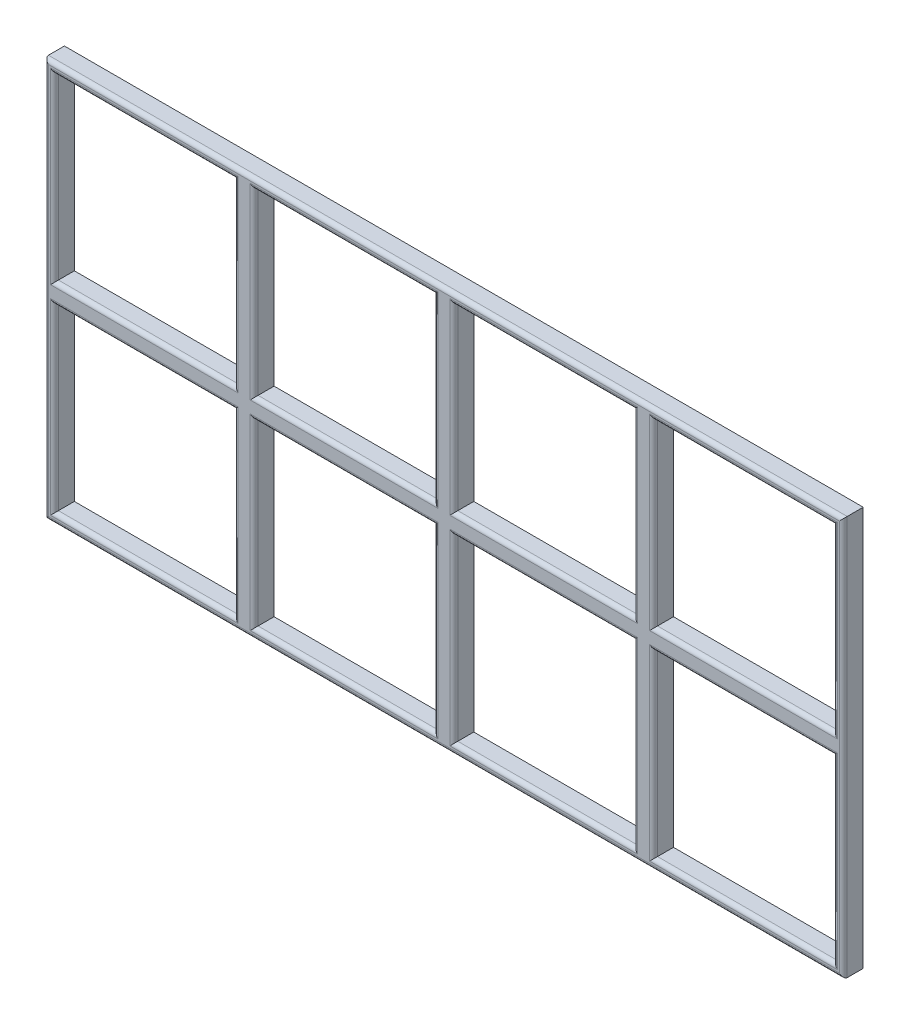
from build123d import *

# Parameters (mm, degrees)
SKETCH2_W           = 200
SKETCH2_H           = 100
SKETCH2_W_2         = 45
SKETCH2_H_2         = 45
BOSS_EXTRUDE1_DEPTH = 5
FILLET2_R           = 1


with BuildPart() as part:
    # Sketch2 → Boss-Extrude1 (new body)
    with BuildSketch(Plane.XY):
        with Locations((0, 50)):
            Rectangle(SKETCH2_W, SKETCH2_H)
        with Locations((-75, 75)):
            Rectangle(SKETCH2_W_2, SKETCH2_H_2, mode=Mode.SUBTRACT)
        with Locations((-25, 75)):
            Rectangle(SKETCH2_W_2, SKETCH2_H_2, mode=Mode.SUBTRACT)
        with Locations((75, 25)):
            Rectangle(SKETCH2_W_2, SKETCH2_H_2, mode=Mode.SUBTRACT)
        with Locations((25, 75)):
            Rectangle(SKETCH2_W_2, SKETCH2_H_2, mode=Mode.SUBTRACT)
        with Locations((75, 75)):
            Rectangle(SKETCH2_W_2, SKETCH2_H_2, mode=Mode.SUBTRACT)
        with Locations((-75, 25)):
            Rectangle(SKETCH2_W_2, SKETCH2_H_2, mode=Mode.SUBTRACT)
        with Locations((-25, 25)):
            Rectangle(SKETCH2_W_2, SKETCH2_H_2, mode=Mode.SUBTRACT)
        with Locations((25, 25)):
            Rectangle(SKETCH2_W_2, SKETCH2_H_2, mode=Mode.SUBTRACT)
    extrude(amount=BOSS_EXTRUDE1_DEPTH)

    # Fillet2
    fillet2_edges = [part.edges().sort_by_distance(p)[0] for p in [
        (-75, 97.5, 5),
        (-97.5, 75, 5),
        (-75, 52.5, 5),
        (-52.5, 75, 5),
        (-100, 50, 5),
        (-25, 47.5, 5),
        (0, 0, 5),
        (-47.5, 25, 5),
        (-25, 2.5, 5),
        (-2.5, 25, 5),
        (25, 47.5, 5),
        (2.5, 25, 5),
        (25, 2.5, 5),
        (47.5, 25, 5),
        (75, 47.5, 5),
        (52.5, 25, 5),
        (75, 2.5, 5),
        (97.5, 25, 5),
        (100, 50, 5),
        (-25, 97.5, 5),
        (-47.5, 75, 5),
        (-25, 52.5, 5),
        (-2.5, 75, 5),
        (47.5, 75, 5),
        (25, 97.5, 5),
        (2.5, 75, 5),
        (25, 52.5, 5),
        (97.5, 75, 5),
        (75, 97.5, 5),
        (52.5, 75, 5),
        (75, 52.5, 5),
        (0, 100, 5),
        (-52.5, 25, 5),
        (-75, 47.5, 5),
        (-97.5, 25, 5),
        (-75, 2.5, 5),
    ]]
    fillet(fillet2_edges, radius=FILLET2_R)


solid = part.part
